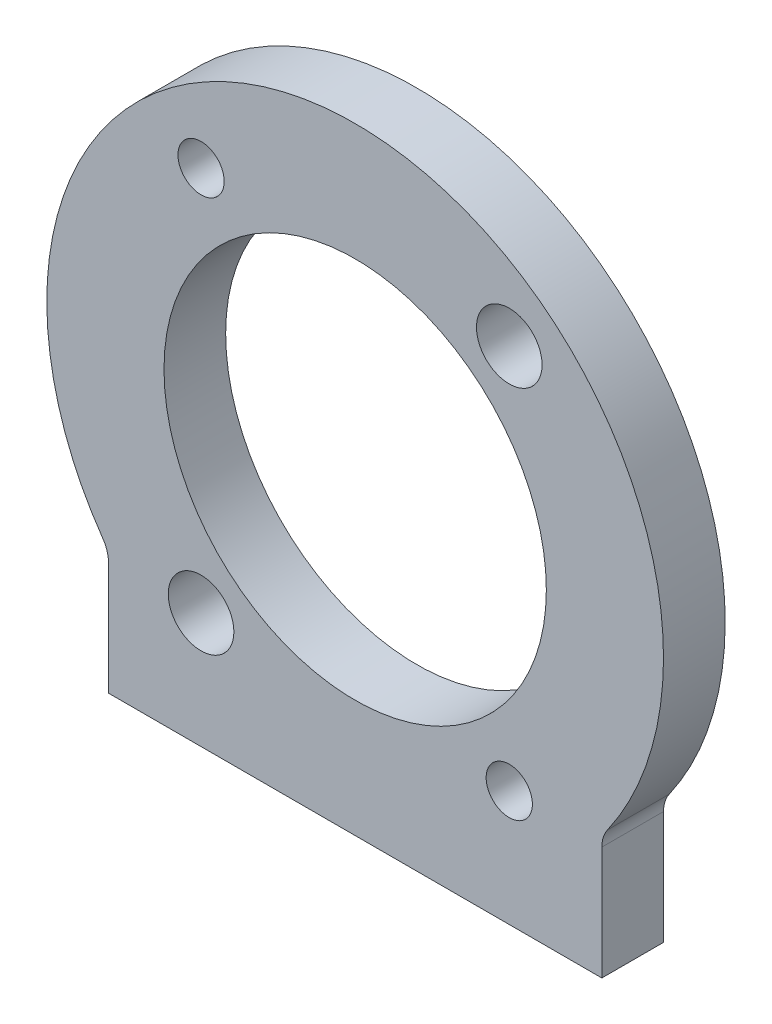
from build123d import *

# Parameters (mm, degrees)
SKETCH1_R           = 19.685
SKETCH1_R_2         = 2.38125
SKETCH1_R_3         = 3.3782
BOSS_EXTRUDE1_DEPTH = 6.35


with BuildPart() as part:
    # Sketch1 → Boss-Extrude1 (new body)
    with BuildSketch(Plane.XY):
        with BuildLine():
            Line((0, 0), (-50.8, 0))
            Line((-50.8, 0), (-50.8, 11.669536858))
            ThreePointArc((-50.8, 11.669536858), (-50.947756279, 12.626835377), (-51.377272727, 13.495033507))
            ThreePointArc((-51.377272727, 13.495033507), (-25.4, 63.5), (0.577272727, 13.495033507))
            ThreePointArc((0.577272727, 13.495033507), (0.147756279, 12.626835377), (0, 11.669536858))
            Line((0, 11.669536858), (0, 0))
        make_face()
        with Locations((-25.4, 31.75)):
            Circle(SKETCH1_R, mode=Mode.SUBTRACT)
        with Locations((-41.267254208, 51.58406776)):
            Circle(SKETCH1_R_2, mode=Mode.SUBTRACT)
        with Locations((-9.532745792, 51.58406776)):
            Circle(SKETCH1_R_3, mode=Mode.SUBTRACT)
        with Locations((-9.532745792, 11.91593224)):
            Circle(SKETCH1_R_2, mode=Mode.SUBTRACT)
        with Locations((-41.267254208, 11.91593224)):
            Circle(SKETCH1_R_3, mode=Mode.SUBTRACT)
    extrude(amount=BOSS_EXTRUDE1_DEPTH)


solid = part.part
